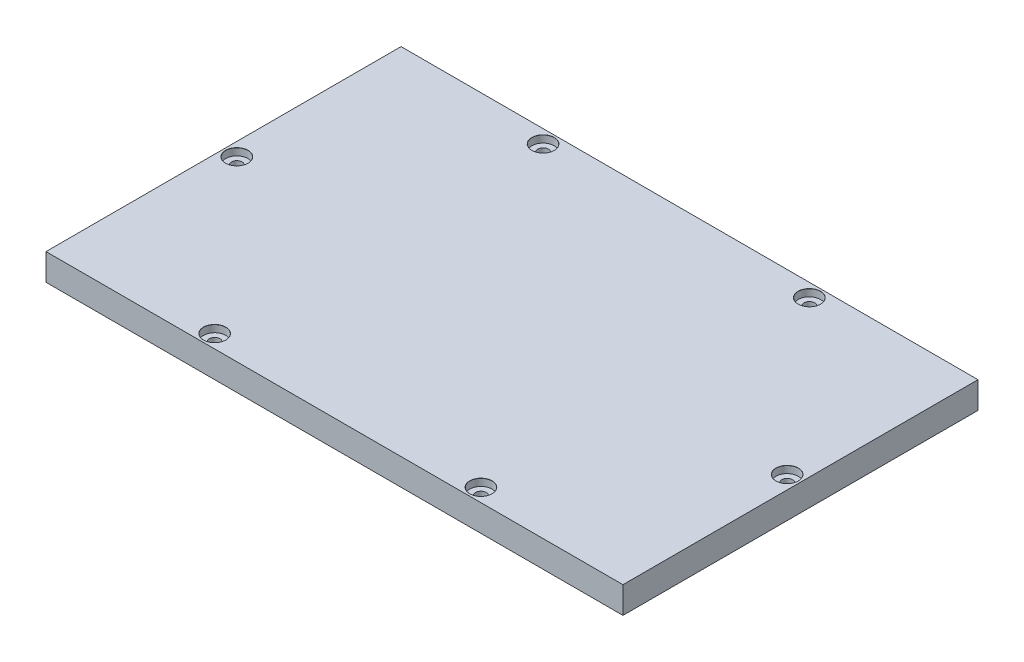
from build123d import *

# Parameters (mm, degrees)
SKIZZE1_W                                    = 130
SKIZZE1_H                                    = 80
AUFSATZ_LINEAR_AUSTRAGEN1_DEPTH              = 6
F_2_4_2_4_DURCHMESSER_BOHRUNG1_D             = 2.4
F_2_4_2_4_DURCHMESSER_BOHRUNG1_DEPTH         = 10
F_2_4_2_4_DURCHMESSER_BOHRUNG1_CSINK_D       = 2.45
F_2_4_2_4_DURCHMESSER_BOHRUNG1_CSINK_ANGLE   = 90
F_2_4_2_4_DURCHMESSER_BOHRUNG1_TIP           = 0.721032743
STIRNSENKUNG_F_R_M2_FLACHKOPFSCHRAUB_2_COUNT = 2
STIRNSENKUNG_F_R_M2_FLACHKOPFSCHRAUB_2_PITCH = 48.918299235
STIRNSENKUNG_F_R_M2_FLACHKOPFSCHRAUB_3_COUNT = 2
STIRNSENKUNG_F_R_M2_FLACHKOPFSCHRAUB_3_PITCH = 74
STIRNSENKUNG_F_R_M2_FLACHKOPFSCHRAUB_4_COUNT = 2
STIRNSENKUNG_F_R_M2_FLACHKOPFSCHRAUB_4_PITCH = 95.268042911
STIRNSENKUNG_F_R_M2_FLACHKOPFSCHRAUB_5_COUNT = 2
STIRNSENKUNG_F_R_M2_FLACHKOPFSCHRAUB_5_PITCH = 99.161484458
STIRNSENKUNG_F_R_M2_FLACHKOPFSCHRAUB_6_COUNT = 2
STIRNSENKUNG_F_R_M2_FLACHKOPFSCHRAUB_6_PITCH = 60


with BuildPart() as part:
    # Skizze1 → Aufsatz-Linear austragen1 (new body)
    with BuildSketch(Plane(origin=(0, 0, 0), x_dir=(1, 0, 0), z_dir=(0, 1, 0))):
        with Locations((65, 40)):
            Rectangle(SKIZZE1_W, SKIZZE1_H)
    extrude(amount=AUFSATZ_LINEAR_AUSTRAGEN1_DEPTH)

    # Ø2.4 (2.4) Durchmesser Bohrung1
    with Locations(Plane(origin=(0, 6, 0), x_dir=(1, 0, 0), z_dir=(0, 1, 0))):
        with Locations((35, 77), (95, 77), (127, 40), (95, 3), (35, 3), (3, 40), (133.088689194, 32.803420387)):
            CounterSinkHole(F_2_4_2_4_DURCHMESSER_BOHRUNG1_D / 2, F_2_4_2_4_DURCHMESSER_BOHRUNG1_CSINK_D / 2, depth=F_2_4_2_4_DURCHMESSER_BOHRUNG1_DEPTH, counter_sink_angle=F_2_4_2_4_DURCHMESSER_BOHRUNG1_CSINK_ANGLE)
            with Locations((0, 0, -(F_2_4_2_4_DURCHMESSER_BOHRUNG1_DEPTH + F_2_4_2_4_DURCHMESSER_BOHRUNG1_TIP / 2))):  # 118° drill point
                Cone(0, F_2_4_2_4_DURCHMESSER_BOHRUNG1_D / 2, F_2_4_2_4_DURCHMESSER_BOHRUNG1_TIP, mode=Mode.SUBTRACT)

    # Skizze7 → Stirnsenkung für M2 Flachkopfschraube mit Schlitz1 (revolve, cut)
    with BuildSketch(Plane(origin=(95, 6, -3), x_dir=(0, 0, 1), z_dir=(1, 0, 0))):
        Polygon((0, 0), (0, 2.721032743), (1.2, 2), (1.2, 1.6), (2.5, 1.6), (2.5, 0.025), (2.525, 0), align=None)
    stirnsenkung_f_r_m2_flachkopfschraube_mi = revolve(axis=Axis((95, 12.35, -3), (0, -1, 0)), mode=Mode.SUBTRACT)

    # Stirnsenkung f_r M2 Flachkopfschraub 2: Stirnsenkung für M2 Flachkopfschraube mit Schlitz1 ×2
    with Locations(*[Vector(0.6541519329315842, 0, -0.7563631724521444) * (i * STIRNSENKUNG_F_R_M2_FLACHKOPFSCHRAUB_2_PITCH) for i in range(1, STIRNSENKUNG_F_R_M2_FLACHKOPFSCHRAUB_2_COUNT)]):
        add(stirnsenkung_f_r_m2_flachkopfschraube_mi, mode=Mode.SUBTRACT)

    # Stirnsenkung f_r M2 Flachkopfschraub 3: Stirnsenkung für M2 Flachkopfschraube mit Schlitz1 ×2
    with Locations(*[(0, 0, -i * STIRNSENKUNG_F_R_M2_FLACHKOPFSCHRAUB_3_PITCH) for i in range(1, STIRNSENKUNG_F_R_M2_FLACHKOPFSCHRAUB_3_COUNT)]):
        add(stirnsenkung_f_r_m2_flachkopfschraube_mi, mode=Mode.SUBTRACT)

    # Stirnsenkung f_r M2 Flachkopfschraub 4: Stirnsenkung für M2 Flachkopfschraube mit Schlitz1 ×2
    with Locations(*[Vector(-0.6298019584212194, 0, -0.7767557487195037) * (i * STIRNSENKUNG_F_R_M2_FLACHKOPFSCHRAUB_4_PITCH) for i in range(1, STIRNSENKUNG_F_R_M2_FLACHKOPFSCHRAUB_4_COUNT)]):
        add(stirnsenkung_f_r_m2_flachkopfschraube_mi, mode=Mode.SUBTRACT)

    # Stirnsenkung f_r M2 Flachkopfschraub 5: Stirnsenkung für M2 Flachkopfschraube mit Schlitz1 ×2
    with Locations(*[Vector(-0.9277795759357077, 0, -0.37312874249588235) * (i * STIRNSENKUNG_F_R_M2_FLACHKOPFSCHRAUB_5_PITCH) for i in range(1, STIRNSENKUNG_F_R_M2_FLACHKOPFSCHRAUB_5_COUNT)]):
        add(stirnsenkung_f_r_m2_flachkopfschraube_mi, mode=Mode.SUBTRACT)

    # Stirnsenkung f_r M2 Flachkopfschraub 6: Stirnsenkung für M2 Flachkopfschraube mit Schlitz1 ×2
    with Locations(*[(-i * STIRNSENKUNG_F_R_M2_FLACHKOPFSCHRAUB_6_PITCH, 0, 0) for i in range(1, STIRNSENKUNG_F_R_M2_FLACHKOPFSCHRAUB_6_COUNT)]):
        add(stirnsenkung_f_r_m2_flachkopfschraube_mi, mode=Mode.SUBTRACT)


solid = part.part
